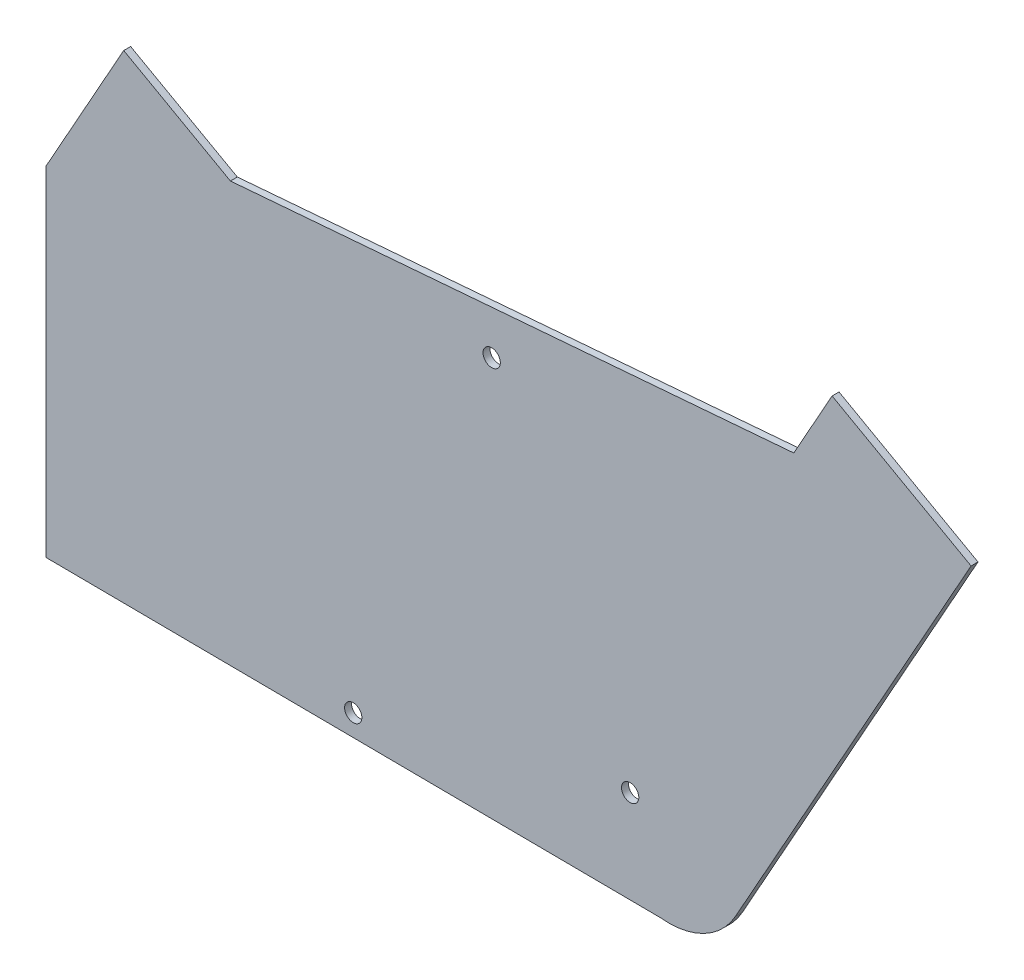
from build123d import *

# Parameters (mm, degrees)
BOSS_EXTRUDE1_DEPTH = 2.54
SKETCH2_R           = 3.175
CUT_EXTRUDE1_DEPTH  = 252.765490419


with BuildPart() as part:
    # Sketch1 → Boss-Extrude1 (new body)
    with BuildSketch(Plane.XY):
        with BuildLine():
            Line((56.475591943, 100.965617501), (70.541585889, 126.112441388))
            Line((70.541585889, 126.112441388), (121.527407416, 97.59328286))
            Line((121.527407416, 97.59328286), (35.036266464, -57.033364763))
            ThreePointArc((35.036266464, -57.033364763), (23.451402169, -68.229473927), (7.610684951, -71.167776012))
            Line((7.610684951, -71.167776012), (-217.887729561, -69.42085916))
            Line((-217.887729561, -69.42085916), (-217.887729561, 54.938377315))
            Line((-217.887729561, 54.938377315), (-189.368571032, 105.924198843))
            Line((-189.368571032, 105.924198843), (-150.227007979, 84.030181873))
            Line((-150.227007979, 84.030181873), (56.475591943, 100.965617501))
        make_face()
    extrude(amount=BOSS_EXTRUDE1_DEPTH)

    # Sketch2 → Cut-Extrude1 (cut, through all)
    with BuildSketch(Plane.XY.offset(2.54)):
        with BuildLine():
            ThreePointArc((-0.387630151, -36.96777295), (-1.317566121, -34.72270892), (-3.562630151, -33.79277295))
            Line((-3.562630151, -33.79277295), (-3.562630151, -40.14277295))
            ThreePointArc((-3.562630151, -40.14277295), (-1.317566121, -39.212836981), (-0.387630151, -36.96777295))
        make_face()
        with BuildLine():
            Line((-3.562630151, -40.14277295), (-3.562630151, -33.79277295))
            ThreePointArc((-3.562630151, -33.79277295), (-6.737630151, -36.96777295), (-3.562630151, -40.14277295))
        make_face()
        with Locations((-54.362630151, 75.80822705)):
            Circle(SKETCH2_R)
        with Locations((-105.162630151, -62.36777295)):
            Circle(SKETCH2_R)
    extrude(amount=-CUT_EXTRUDE1_DEPTH, mode=Mode.SUBTRACT)


solid = part.part
